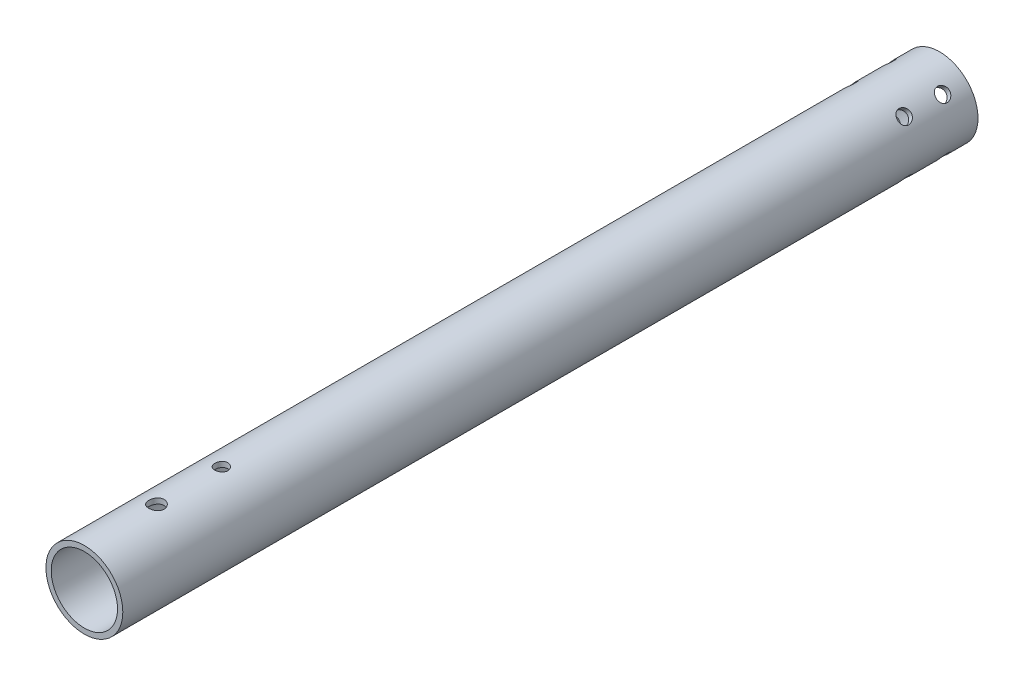
from build123d import *

# Parameters (mm, degrees)
SKETCH1_R               = 8
SKETCH1_R_2             = 6.9
BOSS_EXTRUDE1_DEPTH     = 163
SKETCH3_R               = 8
SKETCH3_R_2             = 6.9
BOSS_EXTRUDE3_DEPTH     = 15
CUT_EXTRUDE1_DEPTH      = 179.359188157
CUT_EXTRUDE1_DEPTH_BACK = 179.359188157
SKETCH2_R               = 1.6
SKETCH2_R_2             = 1.35
SKETCH4_R               = 1.4
CUT_EXTRUDE2_DEPTH      = 179.359188267
CIRPATTERN1_COUNT       = 2
CIRPATTERN1_ANGLE       = 90


with BuildPart() as part:
    # Sketch1 → Boss-Extrude1 (new body)
    with BuildSketch(Plane.XY):
        Circle(SKETCH1_R)
        Circle(SKETCH1_R_2, mode=Mode.SUBTRACT)
    extrude(amount=BOSS_EXTRUDE1_DEPTH)

    # Sketch3 → Boss-Extrude3 (add)
    with BuildSketch(Plane.XY.offset(163)):
        Circle(SKETCH3_R)
        Circle(SKETCH3_R_2, mode=Mode.SUBTRACT)
    extrude(amount=BOSS_EXTRUDE3_DEPTH)

    # Sketch2 → Cut-Extrude1 (cut, two sides: drawn at the far end of the back side and taken through both)
    with BuildSketch(Plane(origin=(0, 0, 0), x_dir=(1, 0, 0), z_dir=(0, 1, 0)).offset(-CUT_EXTRUDE1_DEPTH_BACK)):
        with Locations(Location((0, -163, 0), (0, 0, 270))):
            Circle(SKETCH2_R)
        with Locations(Location((0, -149.5, 0), (0, 0, 270))):
            Circle(SKETCH2_R_2)
    extrude(amount=CUT_EXTRUDE1_DEPTH + CUT_EXTRUDE1_DEPTH_BACK, mode=Mode.SUBTRACT)

    # Sketch4 → Cut-Extrude2 (cut, symmetric)
    with BuildSketch(Plane(origin=(0, 0, 0), x_dir=(0, 0, 1), z_dir=(0.7071067811865464, 0.7071067811865488, 0))):
        with Locations(Location((13, 0, 0), (0, 0, 270))):
            Circle(SKETCH4_R)
        with Locations(Location((5, 0, 0), (0, 0, 270))):
            Circle(SKETCH4_R)
    cut_extrude2 = extrude(amount=CUT_EXTRUDE2_DEPTH, both=True, mode=Mode.SUBTRACT)

    # CirPattern1: Cut-Extrude2 ×2 about axis
    cirpattern1_axis = Axis((0, 0, -8.9), (0, 0, 1))
    for i in range(1, CIRPATTERN1_COUNT):
        add(cut_extrude2.rotate(cirpattern1_axis, i * CIRPATTERN1_ANGLE / (CIRPATTERN1_COUNT - 1)), mode=Mode.SUBTRACT)


solid = part.part
